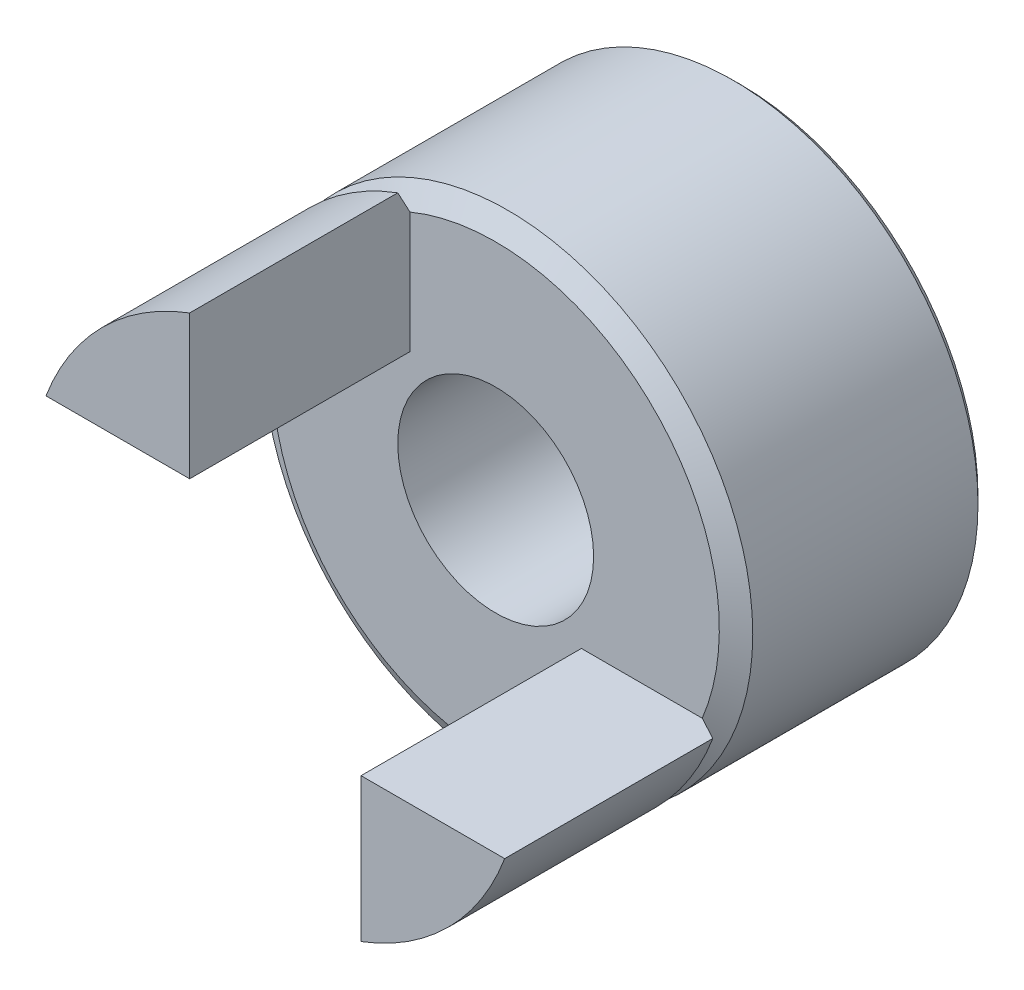
from build123d import *

# Parameters (mm, degrees)
SKETCH_1_R      = 10
SKETCH_1_R_2    = 4
EXTRUDE_1_DEPTH = 10
CHAMFER_1_SIZE  = 0.3
EXTRUDE_2_DEPTH = 9


with BuildPart() as part:
    # 스케치1 → 보스-돌출1 (new body)
    with BuildSketch(Plane.XY):
        Circle(SKETCH_1_R)
        Circle(SKETCH_1_R_2, mode=Mode.SUBTRACT)
    extrude(amount=EXTRUDE_1_DEPTH)

    # 모따기1
    chamfer_1_edges = [part.edges().sort_by_distance(p)[0] for p in [
        (-10, 0, 0),
        (-4, 0, 0),
    ]]
    chamfer(chamfer_1_edges, length=CHAMFER_1_SIZE)

    # 스케치2 → 보스-돌출2 (add)
    with BuildSketch(Plane.XY.offset(10)):
        with BuildLine():
            ThreePointArc((-3.5, 9.367496998), (-7.071067812, 7.071067812), (-9.367496998, 3.5))
            Line((-9.367496998, 3.5), (-3.5, 3.5))
            Line((-3.5, 3.5), (-3.5, 9.367496998))
        make_face()
        with BuildLine():
            Line((9.367496998, -3.5), (3.5, -3.5))
            Line((3.5, -3.5), (3.5, -9.367496998))
            ThreePointArc((3.5, -9.367496998), (7.071067812, -7.071067812), (9.367496998, -3.5))
        make_face()
    extrude(amount=EXTRUDE_2_DEPTH)

    # 스케치3 → 컷-회전1 (revolve, cut)
    with BuildSketch(Plane(origin=(0, 0, 0), x_dir=(1, 0, 0), z_dir=(0, 1, 0)), mode=Mode.PRIVATE) as cut_revolve_1_sk:
        Polygon((9.133974596, -10), (10, -10.5), (10, -9.5), align=None)
    revolve(cut_revolve_1_sk.sketch.rotate(Axis((0, 0, 0), (0, 0, 1)), 180), axis=Axis((0, 0, 0), (0, 0, 1)), mode=Mode.SUBTRACT)


solid = part.part
